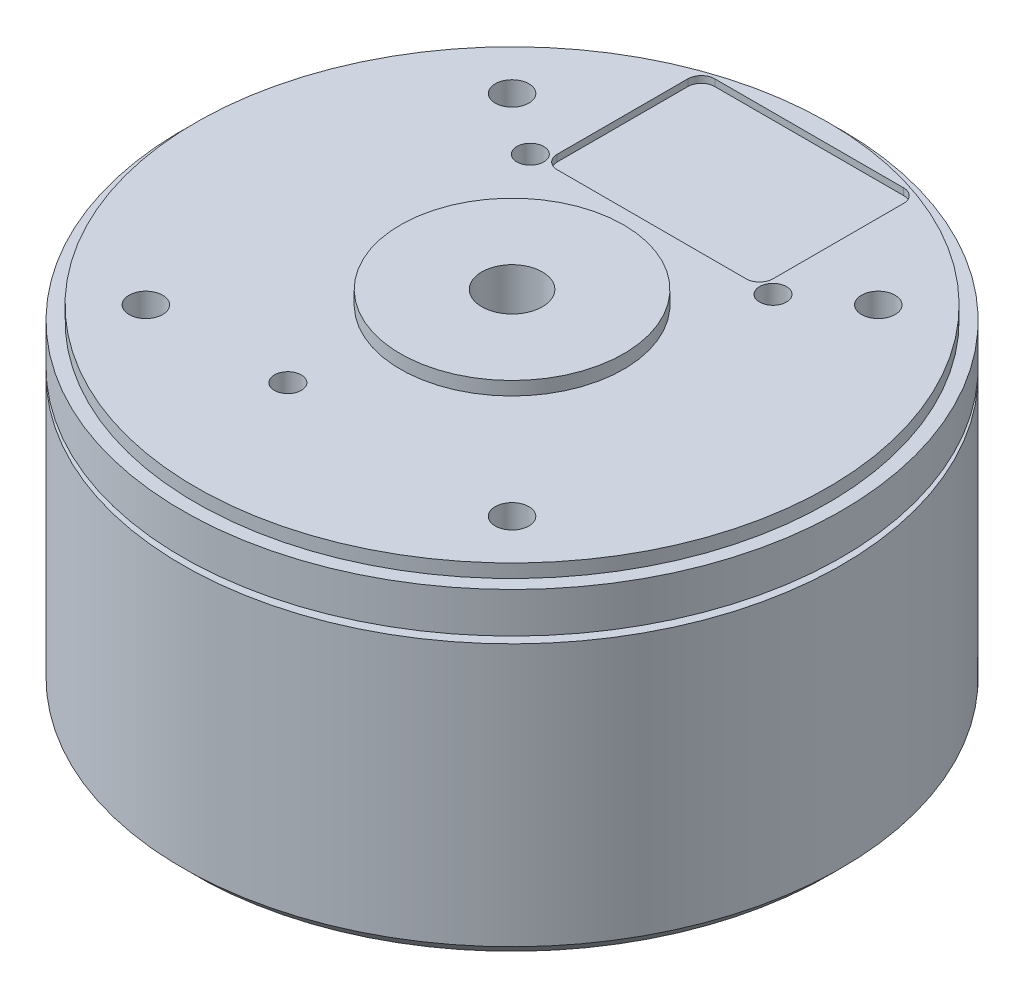
from build123d import *

# Parameters (mm, degrees)
CHAMFER_1_SIZE      = 1
SKETCH_2_R          = 1.25
SKETCH_2_R_2        = 1
CUT_EXTRUDE_1_DEPTH = 4
SKETCH_3_R          = 1.5
CUT_EXTRUDE_2_DEPTH = 4
SKETCH_4_R          = 6.3
CUT_EXTRUDE_3_DEPTH = 1
CUT_EXTRUDE_4_DEPTH = 0.5


with BuildPart() as part:
    # 草图1 → 旋转1 (revolve)
    with BuildSketch(Plane.XY, mode=Mode.PRIVATE) as revolve_1_sk:
        Polygon((2.25, 0), (2.25, 26), (8.3, 26), (8.3, 25), (23.5, 25), (23.5, 24), (24.5, 24), (24.5, 21), (23.5, 21), (23.5, 20.5), (24.5, 20.5), (24.5, 0), align=None)
    revolve(revolve_1_sk.sketch.rotate(Axis((0, 0, 0), (0, 1, 0)), 90), axis=Axis((0, 0, 0), (0, 1, 0)))

    # 倒角1
    chamfer_1_edges = [part.edges().sort_by_distance(p)[0] for p in [
        (0, 0, 24.5),
    ]]
    chamfer(chamfer_1_edges, length=CHAMFER_1_SIZE)

    # 草图2 → 切除-拉伸1 (cut)
    with BuildSketch(Plane(origin=(0, 25, 0), x_dir=(1, 0, 0), z_dir=(0, 1, 0))):
        with Locations(Location((13.611805538, 13.611805538, 0), (0, 0, 270))):
            Circle(SKETCH_2_R)
        with Locations(Location((13.611805538, -13.611805538, 0), (0, 0, 270))):
            Circle(SKETCH_2_R)
        with Locations(Location((-13.611805538, -13.611805538, 0), (0, 0, 270))):
            Circle(SKETCH_2_R)
        with Locations(Location((-13.611805538, 13.611805538, 0), (0, 0, 270))):
            Circle(SKETCH_2_R)
        with Locations(Location((-9.020811649, 10.377256728, 0), (0, 0, 270))):
            Circle(SKETCH_2_R_2)
        with Locations(Location((-3.326426064, -13.341566236, 0), (0, 0, 270))):
            Circle(SKETCH_2_R_2)
        with Locations(Location((9.020811649, 10.377256728, 0), (0, 0, 90))):
            Circle(SKETCH_2_R_2)
    extrude(amount=-CUT_EXTRUDE_1_DEPTH, mode=Mode.SUBTRACT)

    # 草图3 → 切除-拉伸2 (cut)
    with BuildSketch(Plane.XZ):
        with Locations(Location((0, 9.5, 0), (0, 0, 270))):
            Circle(SKETCH_3_R)
        with Locations(Location((8.838834765, 8.838834765, 0), (0, 0, 270))):
            Circle(SKETCH_3_R)
        with Locations(Location((9.5, 0, 0), (0, 0, 270))):
            Circle(SKETCH_3_R)
        with Locations(Location((8.838834765, -8.838834765, 0), (0, 0, 270))):
            Circle(SKETCH_3_R)
        with Locations(Location((0, -9.5, 0), (0, 0, 270))):
            Circle(SKETCH_3_R)
        with Locations(Location((-8.838834765, -8.838834765, 0), (0, 0, 270))):
            Circle(SKETCH_3_R)
        with Locations(Location((-9.5, 0, 0), (0, 0, 270))):
            Circle(SKETCH_3_R)
        with Locations(Location((-8.838834765, 8.838834765, 0), (0, 0, 270))):
            Circle(SKETCH_3_R)
    extrude(amount=-CUT_EXTRUDE_2_DEPTH, mode=Mode.SUBTRACT)

    # 草图4 → 切除-拉伸3 (cut)
    with BuildSketch(Plane.XZ):
        with Locations(Location((0, 0, 0), (0, 0, 270))):
            Circle(SKETCH_4_R)
    extrude(amount=-CUT_EXTRUDE_3_DEPTH, mode=Mode.SUBTRACT)

    # 草图5 → 切除-拉伸4 (cut)
    with BuildSketch(Plane(origin=(0, 25, 0), x_dir=(1, 0, 0), z_dir=(0, 1, 0))):
        with BuildLine():
            Line((-7.020811649, 10.377256728), (7.020811649, 10.377256728))
            ThreePointArc((7.020811649, 10.377256728), (7.72791843, 10.670149947), (8.020811649, 11.377256728))
            Line((8.020811649, 11.377256728), (8.020811649, 21.088833842))
            ThreePointArc((8.020811649, 21.088833842), (7.72791843, 21.795940623), (7.020811649, 22.088833842))
            Line((7.020811649, 22.088833842), (-7.020811649, 22.088833842))
            ThreePointArc((-7.020811649, 22.088833842), (-7.72791843, 21.795940623), (-8.020811649, 21.088833842))
            Line((-8.020811649, 21.088833842), (-8.020811649, 11.377256728))
            ThreePointArc((-8.020811649, 11.377256728), (-7.72791843, 10.670149947), (-7.020811649, 10.377256728))
        make_face()
    extrude(amount=-CUT_EXTRUDE_4_DEPTH, mode=Mode.SUBTRACT)


solid = part.part
